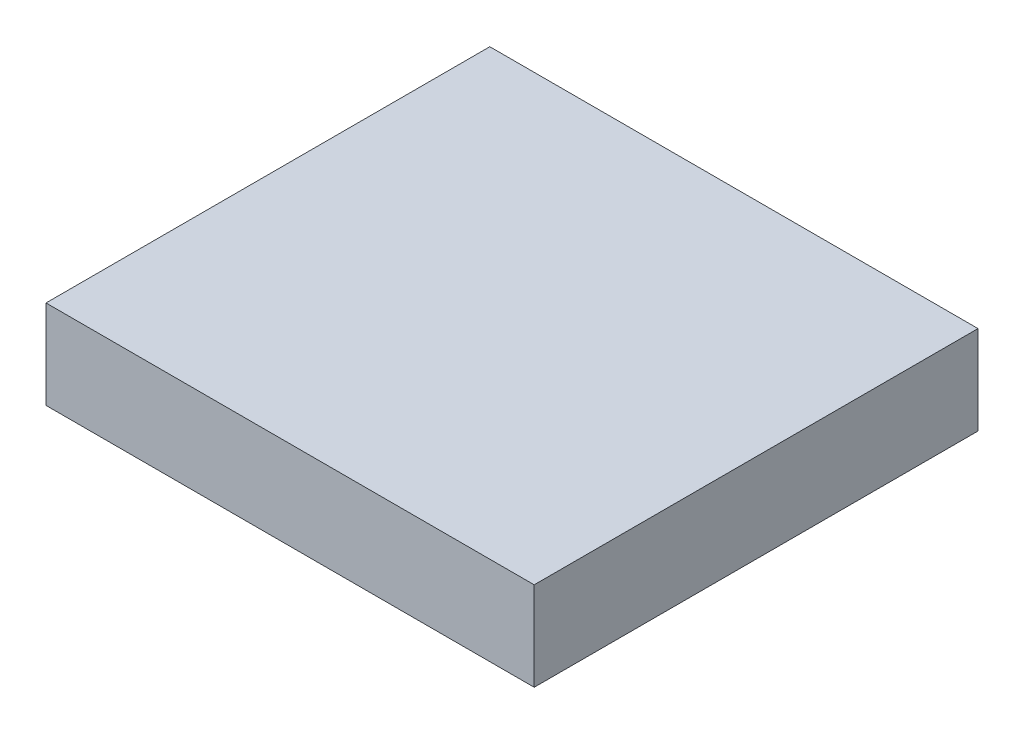
from build123d import *

# Parameters (mm, degrees)
SKETCH1_W           = 11
SKETCH1_H           = 10
BOSS_EXTRUDE1_DEPTH = 2


with BuildPart() as part:
    # Sketch1 → Boss-Extrude1 (new body)
    with BuildSketch(Plane(origin=(0, 0, 0), x_dir=(1, 0, 0), z_dir=(0, 1, 0))):
        Rectangle(SKETCH1_W, SKETCH1_H)
    extrude(amount=BOSS_EXTRUDE1_DEPTH)


solid = part.part
